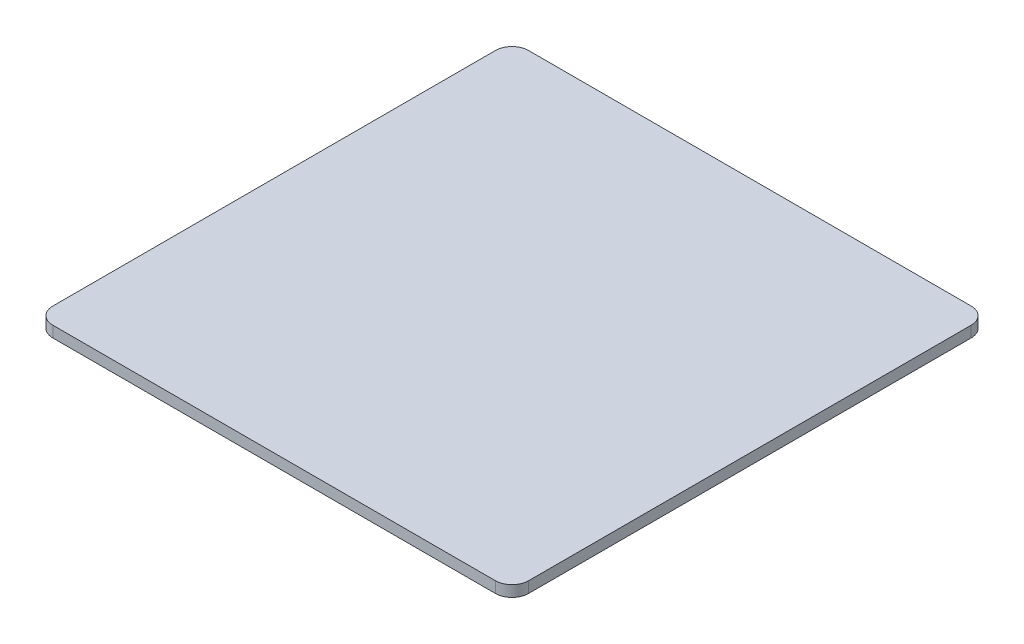
from build123d import *

# Parameters (mm, degrees)
SKETCH1_W           = 86
SKETCH1_H           = 86
BOSS_EXTRUDE1_DEPTH = 2
FILLET1_R           = 3


with BuildPart() as part:
    # Sketch1 → Boss-Extrude1 (new body)
    with BuildSketch(Plane(origin=(0, 0, 0), x_dir=(1, 0, 0), z_dir=(0, 1, 0))):
        Rectangle(SKETCH1_W, SKETCH1_H)
    extrude(amount=BOSS_EXTRUDE1_DEPTH)

    # Fillet1
    fillet1_edges = [part.edges().sort_by_distance(p)[0] for p in [
        (43, 1, 43),
        (-43, 1, 43),
        (-43, 1, -43),
        (43, 1, -43),
    ]]
    fillet(fillet1_edges, radius=FILLET1_R)


solid = part.part
